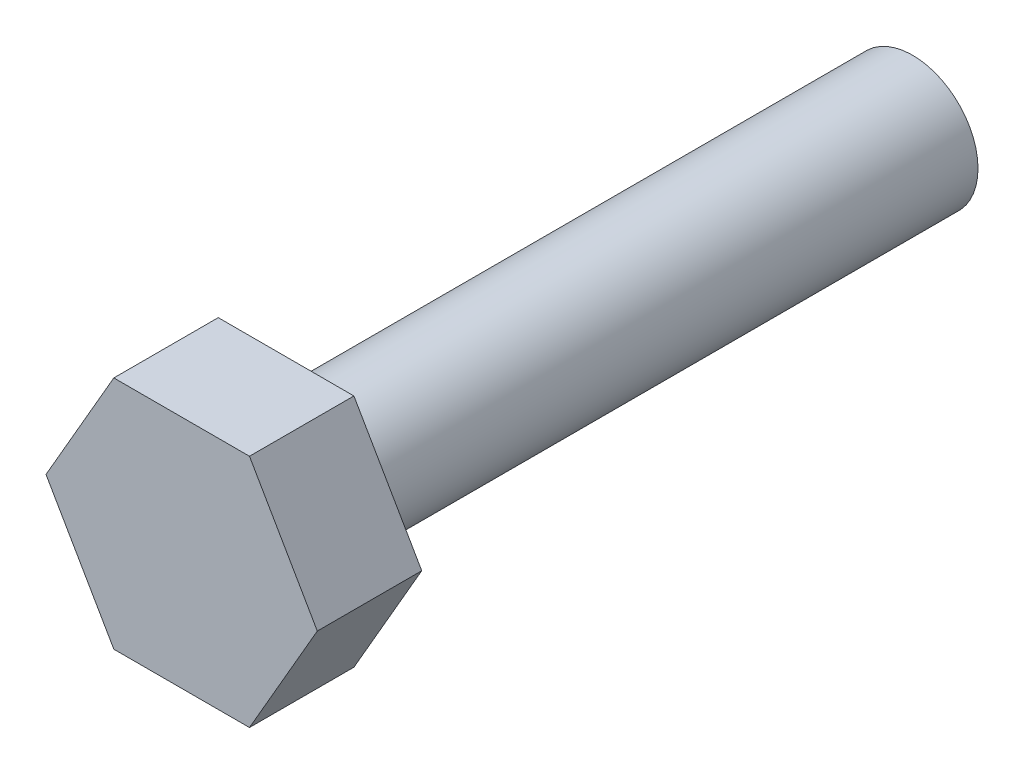
from build123d import *

# Parameters (mm, degrees)
ESQUISSE1_R        = 3.9751
BOSS_EXTRU_1_DEPTH = 38.1
BOSS_EXTRU_2_DEPTH = 6.35


with BuildPart() as part:
    # Esquisse1 → Boss.-Extru.1 (new body)
    with BuildSketch(Plane.XY):
        Circle(ESQUISSE1_R)
    extrude(amount=-BOSS_EXTRU_1_DEPTH)

    # Esquisse2 → Boss.-Extru.2 (add)
    with BuildSketch(Plane.XY):
        Polygon((8.248891971, 0), (4.124445986, 7.14375), (-4.124445986, 7.14375), (-8.248891971, 0), (-4.124445986, -7.14375), (4.124445986, -7.14375), align=None)
    extrude(amount=BOSS_EXTRU_2_DEPTH)


solid = part.part
